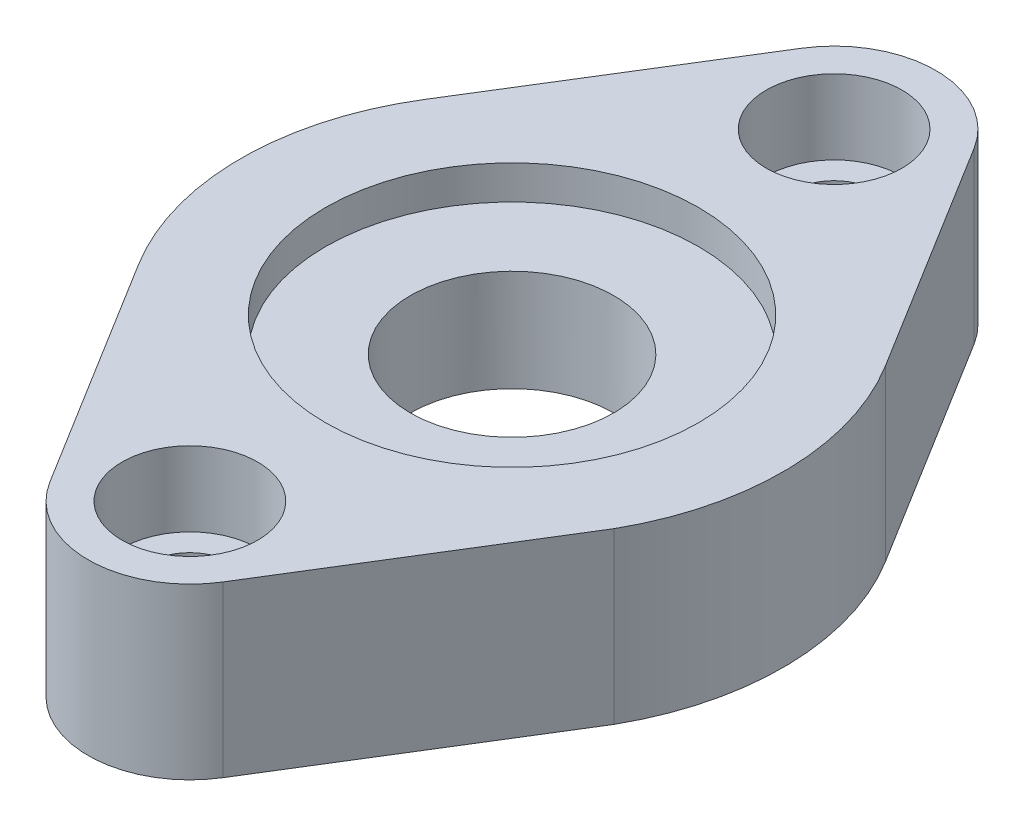
from build123d import *

# Parameters (mm, degrees)
BOSS_EXTRUDE1_DEPTH = 10
SKETCH2_R           = 3.99997531
SKETCH2_R_2         = 4
CUT_EXTRUDE1_DEPTH  = 4.4
CUT_EXTRUDE2_REACH  = 32.207
SKETCH3_R           = 2.5
SKETCH4_R           = 11
CUT_EXTRUDE3_DEPTH  = 2
CUT_EXTRUDE4_REACH  = 32.743
SKETCH5_R           = 6
CUT_EXTRUDE5_START  = -2
SKETCH6_R           = 11
CUT_EXTRUDE5_DEPTH  = 2


with BuildPart() as part:
    # Sketch1 → Boss-Extrude1 (new body)
    with BuildSketch(Plane(origin=(0, 0, 0), x_dir=(1, 0, 0), z_dir=(0, 1, 0))):
        with BuildLine():
            Line((-5.103019764, 22.15600792), (-13.605911567, 8.419165811))
            ThreePointArc((-13.605911567, 8.419165811), (-16.001261955, -0.002028565), (-13.605722542, -8.423169172))
            Line((-13.605722542, -8.423169172), (-5.102675537, -22.159834758))
            ThreePointArc((-5.102675537, -22.159834758), (-6.8217e-05, -25.001848451), (5.101614332, -22.158175041))
            Line((5.101614332, -22.158175041), (13.912148597, -7.902456622))
            ThreePointArc((13.912148597, -7.902456622), (15.995958201, 0.300682208), (13.603482502, 8.419167853))
            Line((13.603482502, 8.419167853), (5.100590702, 22.156009965))
            ThreePointArc((5.100590702, 22.156009965), (-0.0012151, 24.998151536), (-5.103019764, 22.15600792))
        make_face()
    extrude(amount=BOSS_EXTRUDE1_DEPTH)

    # Sketch2 → Cut-Extrude1 (cut)
    with BuildSketch(Plane(origin=(0, 10, 0), x_dir=(1, 0, 0), z_dir=(0, 1, 0))):
        with Locations((-0.001213898, 18.998067086)):
            Circle(SKETCH2_R)
        with Locations((-6.8217e-05, -19.001848451)):
            Circle(SKETCH2_R_2)
    extrude(amount=-CUT_EXTRUDE1_DEPTH, mode=Mode.SUBTRACT)

    # Sketch3 → Cut-Extrude2 (cut, up to next)
    with BuildSketch(Plane(origin=(0, 5.6, 0), x_dir=(1, 0, 0), z_dir=(0, 1, 0)), mode=Mode.PRIVATE) as cut_extrude2_sk1:
        with Locations((-0.001213898, 18.998067086)):
            Circle(SKETCH3_R)
    cut_extrude2_tool1 = extrude(cut_extrude2_sk1.sketch, amount=-CUT_EXTRUDE2_REACH, mode=Mode.PRIVATE) & part.part
    # Sketch3 → Cut-Extrude2 (cut, up to next)
    with BuildSketch(Plane(origin=(0, 5.6, 0), x_dir=(1, 0, 0), z_dir=(0, 1, 0)), mode=Mode.PRIVATE) as cut_extrude2_sk2:
        with Locations((-6.8217e-05, -19.001848451)):
            Circle(SKETCH3_R)
    cut_extrude2_tool2 = extrude(cut_extrude2_sk2.sketch, amount=-CUT_EXTRUDE2_REACH, mode=Mode.PRIVATE) & part.part
    add(cut_extrude2_tool1.solids().sort_by_distance((-0.001214, 5.6, -18.998067))[0], mode=Mode.SUBTRACT)
    add(cut_extrude2_tool2.solids().sort_by_distance((-6.8e-05, 5.6, 19.001848))[0], mode=Mode.SUBTRACT)

    # Sketch4 → Cut-Extrude3 (cut)
    with BuildSketch(Plane(origin=(0, 10, 0), x_dir=(1, 0, 0), z_dir=(0, 1, 0))):
        Circle(SKETCH4_R)
    extrude(amount=-CUT_EXTRUDE3_DEPTH, mode=Mode.SUBTRACT)

    # Sketch5 → Cut-Extrude4 (cut, up to next)
    with BuildSketch(Plane(origin=(0, 8, 0), x_dir=(1, 0, 0), z_dir=(0, 1, 0)), mode=Mode.PRIVATE) as cut_extrude4_sk1:
        Circle(SKETCH5_R)
    cut_extrude4_tool1 = extrude(cut_extrude4_sk1.sketch, amount=-CUT_EXTRUDE4_REACH, mode=Mode.PRIVATE) & part.part
    add(cut_extrude4_tool1.solids().sort_by_distance((0, 8, 0))[0], mode=Mode.SUBTRACT)

    # Sketch6 → Cut-Extrude5 (cut)
    with BuildSketch(Plane.XZ.offset(CUT_EXTRUDE5_START)):
        Circle(SKETCH6_R)
    extrude(amount=CUT_EXTRUDE5_DEPTH, mode=Mode.SUBTRACT)


solid = part.part
